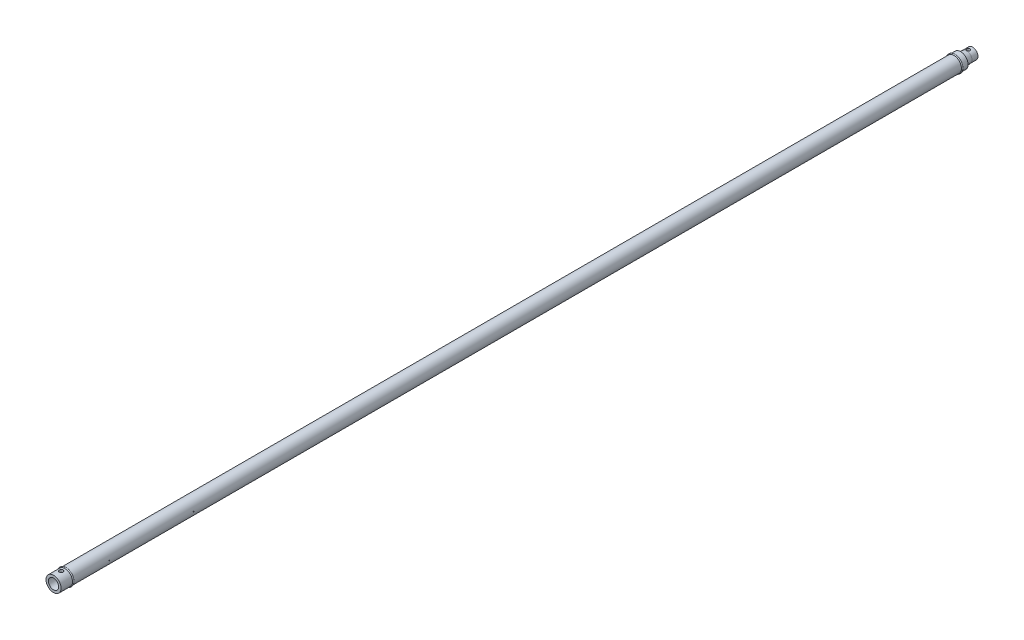
from build123d import *

# Parameters (mm, degrees)
SKETCH1_R               = 25
SKETCH1_R_2             = 22
EXTRUDE_THIN1_DEPTH     = 1475
SKETCH2_R               = 25
SKETCH2_R_2             = 17
EXTRUDE_THIN2_DEPTH     = 40
SKETCH4_R               = 25
SKETCH4_R_2             = 17
EXTRUDE_THIN3_DEPTH     = 20
SKETCH3_R               = 2
SKETCH5_R               = 20
BOSS_EXTRUDE1_DEPTH     = 20
BOSS_EXTRUDE1_TAPER     = 6
SKETCH7_R               = 17.897915295
BOSS_EXTRUDE2_DEPTH     = 20
CUT_EXTRUDE1_DEPTH      = 1536.474845125
CUT_EXTRUDE1_DEPTH_BACK = 1536.474845125
SKETCH6_R               = 6.5
SKETCH6_R_2             = 5.5
CUT_EXTRUDE2_DEPTH      = 1536.474845225
CUT_EXTRUDE2_DEPTH_BACK = 1536.474845225
SKETCH9_R               = 1.5


with BuildPart() as part:
    # Sketch1 → Extrude-Thin1 (new, symmetric)
    with BuildSketch(Plane.XY):
        Circle(SKETCH1_R)
        Circle(SKETCH1_R_2, mode=Mode.SUBTRACT)
    extrude(amount=EXTRUDE_THIN1_DEPTH, both=True)



with BuildPart() as body_2:
    # Sketch2 → Extrude-Thin2 (new body)
    with BuildSketch(Plane.XY.offset(1475)):
        Circle(SKETCH2_R)
        Circle(SKETCH2_R_2, mode=Mode.SUBTRACT)
    extrude(amount=EXTRUDE_THIN2_DEPTH)


with BuildPart() as body_3:
    # Sketch4 → Extrude-Thin3 (new body)
    with BuildSketch(Plane(origin=(0, 0, -1475), x_dir=(-1, 0, 0), z_dir=(0, 0, -1))):
        Circle(SKETCH4_R)
        Circle(SKETCH4_R_2, mode=Mode.SUBTRACT)
    extrude(amount=EXTRUDE_THIN3_DEPTH)

    # Sketch5 → Boss-Extrude1 (add)
    with BuildSketch(Plane(origin=(0, 0, -1495), x_dir=(-1, 0, 0), z_dir=(0, 0, -1))):
        Circle(SKETCH5_R)
    extrude(amount=BOSS_EXTRUDE1_DEPTH, taper=BOSS_EXTRUDE1_TAPER)

    # Sketch7 → Boss-Extrude2 (add)
    with BuildSketch(Plane(origin=(0, 0, -1515), x_dir=(-1, 0, 0), z_dir=(0, 0, -1))):
        Circle(SKETCH7_R)
    extrude(amount=BOSS_EXTRUDE2_DEPTH)


with BuildPart() as part_1:
    add(part.part)

    add(body_2.part)  # Revolve1 merges body 2
    # Sketch3 → Revolve1 (revolve)
    with BuildSketch(Plane(origin=(0, 0, 0), x_dir=(1, 0, 0), z_dir=(0, 1, 0))):
        with Locations((25, -1475)):
            Circle(SKETCH3_R)
        with Locations((25, 1475)):
            Circle(SKETCH3_R)
    revolve(axis=Axis((0, 0, 1515), (0, 0, -1)))


with BuildPart() as cut_extrude1_tool:
    # Sketch6 → Cut-Extrude1 (new, two sides: drawn at the far end of the back side and taken through both)
    with BuildSketch(Plane(origin=(0, 0, 0), x_dir=(1, 0, 0), z_dir=(0, 1, 0)).offset(-CUT_EXTRUDE1_DEPTH_BACK)):
        with Locations((0, -1490)):
            Circle(SKETCH6_R)
        with Locations((0, 1520)):
            Circle(SKETCH6_R_2)
    extrude(amount=CUT_EXTRUDE1_DEPTH + CUT_EXTRUDE1_DEPTH_BACK)


with BuildPart() as part_2:
    add(part_1.part)

    # Cut-Extrude1: cut by cut_extrude1_tool
    add(cut_extrude1_tool.part, mode=Mode.SUBTRACT)

    # Sketch9 → Cut-Extrude2 (cut, two sides: drawn at the far end of the back side and taken through both)
    with BuildSketch(Plane(origin=(0, 0, 0), x_dir=(0, 0, -1), z_dir=(1, 0, 0)).offset(-CUT_EXTRUDE2_DEPTH_BACK)):
        with Locations((-1355, 0)):
            Circle(SKETCH9_R)
        with Locations((-1075, 0)):
            Circle(SKETCH9_R)
    extrude(amount=CUT_EXTRUDE2_DEPTH + CUT_EXTRUDE2_DEPTH_BACK, mode=Mode.SUBTRACT)


with BuildPart() as body_3_1:
    add(body_3.part)

    # Cut-Extrude1: cut by cut_extrude1_tool
    add(cut_extrude1_tool.part, mode=Mode.SUBTRACT)


solid = Compound([part_2.part, body_3_1.part])
